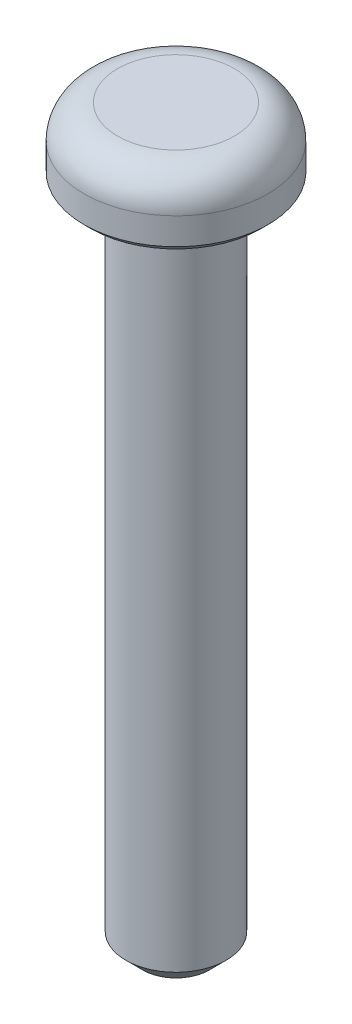
from build123d import *

# Parameters (mm, degrees)
FILLET1_R     = 1
CHAMFER1_SIZE = 0.5
CHAMFER2_SIZE = 0.2


with BuildPart() as part:
    # Sketch1 → Revolve1 (revolve)
    with BuildSketch(Plane.XY, mode=Mode.PRIVATE) as revolve1_sk:
        Polygon((0, 0), (0, 22), (2.75, 22), (2.75, 20), (1.5, 20), (1.5, 0), align=None)
    revolve(revolve1_sk.sketch.rotate(Axis((0, 0, 0), (0, 1, 0)), 90), axis=Axis((0, 0, 0), (0, 1, 0)))

    # Fillet1
    fillet1_edges = [part.edges().sort_by_distance(p)[0] for p in [
        (0, 22, 2.75),
    ]]
    fillet(fillet1_edges, radius=FILLET1_R)

    # Chamfer1
    chamfer1_edges = [part.edges().sort_by_distance(p)[0] for p in [
        (0, 0, 1.5),
    ]]
    chamfer(chamfer1_edges, length=CHAMFER1_SIZE)

    # Chamfer2
    chamfer2_edges = [part.edges().sort_by_distance(p)[0] for p in [
        (0, 20, 2.75),
    ]]
    chamfer(chamfer2_edges, length=CHAMFER2_SIZE)


solid = part.part
